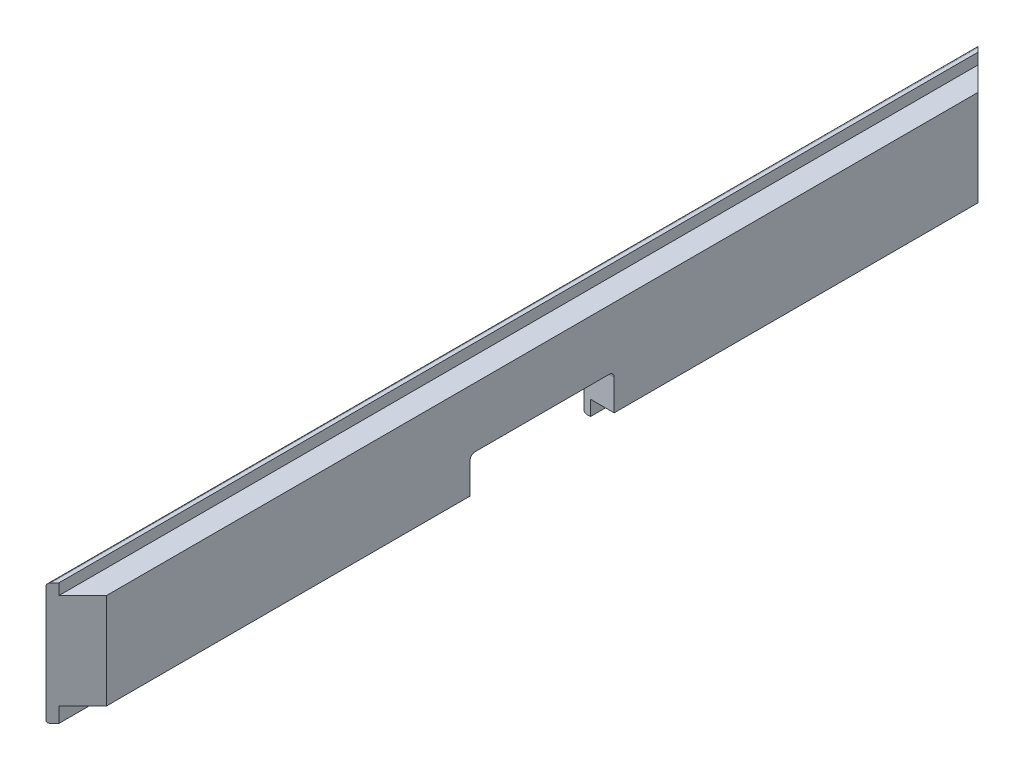
from build123d import *

# Parameters (mm, degrees)
BOSS_EXTRUDE1_DEPTH            = 294.55
FILLET1_R                      = 1.5875
CUT_EXTRUDE1_DEPTH             = 306.043611636
CUT_EXTRUDE1_DEPTH_BACK        = 306.043611636
F_7_9_7_9_DIAMETER_HOLE2_D     = 7.9
F_7_9_7_9_DIAMETER_HOLE2_DEPTH = 15
F_7_9_7_9_DIAMETER_HOLE2_TIP   = 2.373399445
CUT_EXTRUDE3_DEPTH             = 306.043611636
CUT_EXTRUDE3_DEPTH_BACK        = 306.043611636
SKETCH9_W                      = 91.05
SKETCH9_H                      = 25
SKETCH9_H_2                    = 5.6275
SKETCH9_H_3                    = 1.5875
FILLET2_R                      = 3.175


with BuildPart() as part:
    # Sketch1 → Boss-Extrude1 (new, symmetric)
    with BuildSketch(Plane.XY):
        Polygon((0, 77), (0, 0), (4.05, 0), (4.05, 9.525), (19.05, 9.525), (19.05, 70), (4.05, 70), (4.05, 77), align=None)
    extrude(amount=BOSS_EXTRUDE1_DEPTH, both=True)

    # Fillet1
    fillet1_edges = [part.edges().sort_by_distance(p)[0] for p in [
        (0, 0, 0),
        (0, 77, 0),
    ]]
    fillet(fillet1_edges, radius=FILLET1_R)

    # Sketch2 → Cut-Extrude1 (cut, two sides: drawn at the far end of the back side and taken through both)
    with BuildSketch(Plane(origin=(0, 77, 0), x_dir=(1, 0, 0), z_dir=(0, 1, 0)).offset(-CUT_EXTRUDE1_DEPTH_BACK)):
        Polygon((0, 294.55), (19.05, 275.5), (19.05, 294.55), align=None)
        Polygon((19.05, -275.5), (19.05, -294.55), (0, -294.55), align=None)
    extrude(amount=CUT_EXTRUDE1_DEPTH + CUT_EXTRUDE1_DEPTH_BACK, mode=Mode.SUBTRACT)

    # Ø7.9 (7.9) Diameter Hole2
    with Locations(Plane.XZ.offset(-9.525)):
        with Locations((11.55, -104.55), (11.55, 104.55)):
            Hole(F_7_9_7_9_DIAMETER_HOLE2_D / 2, depth=F_7_9_7_9_DIAMETER_HOLE2_DEPTH)
            with Locations((0, 0, -(F_7_9_7_9_DIAMETER_HOLE2_DEPTH + F_7_9_7_9_DIAMETER_HOLE2_TIP / 2))):  # 118° drill point
                Cone(0, F_7_9_7_9_DIAMETER_HOLE2_D / 2, F_7_9_7_9_DIAMETER_HOLE2_TIP, mode=Mode.SUBTRACT)

    # Sketch9 → Cut-Extrude3 (cut, two sides: drawn at the far end of the back side and taken through both)
    with BuildSketch(Plane.ZY.offset(-CUT_EXTRUDE3_DEPTH_BACK)):
        with Locations((0, 19.715)):
            Rectangle(SKETCH9_W, SKETCH9_H)
        with Locations((0, 4.40125)):
            Rectangle(SKETCH9_W, SKETCH9_H_2)
        with Locations((0, 0.79375)):
            Rectangle(SKETCH9_W, SKETCH9_H_3)
    extrude(amount=CUT_EXTRUDE3_DEPTH + CUT_EXTRUDE3_DEPTH_BACK, mode=Mode.SUBTRACT)

    # Fillet2
    fillet2_edges = [part.edges().sort_by_distance(p)[0] for p in [
        (9.525, 32.215, 45.525),
        (9.525, 32.215, -45.525),
    ]]
    fillet(fillet2_edges, radius=FILLET2_R)


solid = part.part
